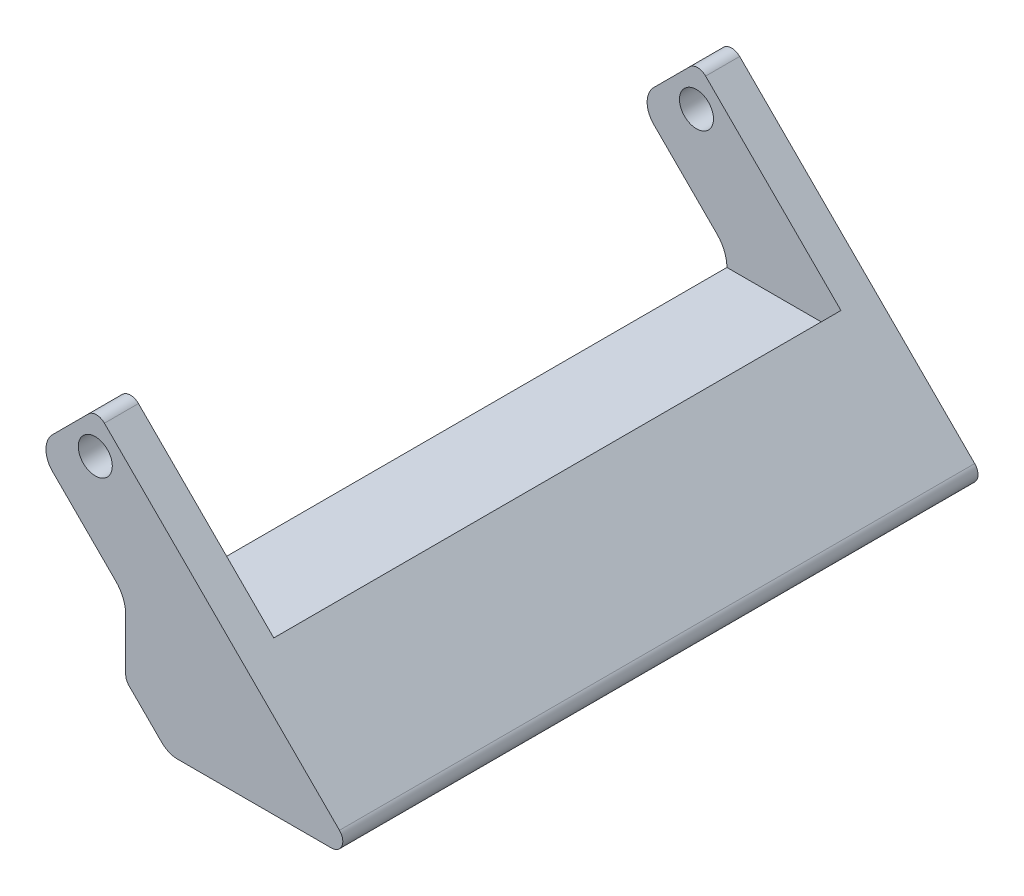
from build123d import *

# Parameters (mm, degrees)
SKETCH1_R           = 1.5
BOSS_EXTRUDE1_DEPTH = 3
BOSS_EXTRUDE2_DEPTH = 25
SKETCH6_W           = 56
SKETCH6_H           = 9.11547301
CUT_EXTRUDE1_DEPTH  = 63.91555103
FILLET1_R           = 2
FILLET2_R           = 1
BOSS_EXTRUDE4_DEPTH = 2.460910909
BOSS_EXTRUDE5_DEPTH = 56
FILLET3_R           = 1


with BuildPart() as part:
    # Sketch1 → Boss-Extrude1 (new body)
    with BuildSketch(Plane.XY):
        with BuildLine():
            ThreePointArc((2.68220241, -18.5), (2.975095629, -19.207106781), (3.68220241, -19.5))
            Line((3.68220241, -19.5), (18.54616344, -19.5))
            ThreePointArc((18.54616344, -19.5), (19.008103207, -19.191341716), (18.899716831, -18.646446609))
            Line((18.899716831, -18.646446609), (15.000000504, -14.746730282))
            Line((15.000000504, -14.746730282), (2.601508845, -2.348238623))
            Line((2.601508845, -2.348238623), (1.894402064, -1.641131842))
            Line((1.894402064, -1.641131842), (2.601508845, -0.934025061))
            Line((2.601508845, -0.934025061), (2.927422074, -0.608111832))
            Line((2.927422074, -0.608111832), (3.634528855, 0.098994949))
            Line((3.634528855, 0.098994949), (2.927422074, 0.806101731))
            Line((2.927422074, 0.806101731), (0.806101731, 2.927422074))
            ThreePointArc((0.806101731, 2.927422074), (0.098994949, 3.220315293), (-0.608111832, 2.927422074))
            Line((-0.608111832, 2.927422074), (-1.641131842, 1.894402064))
            Line((-1.641131842, 1.894402064), (-3.762452186, -0.22691828))
            ThreePointArc((-3.762452186, -0.22691828), (-4.348238623, -1.641131842), (-3.762452186, -3.055345405))
            Line((-3.762452186, -3.055345405), (1.803522753, -8.621320344))
            ThreePointArc((1.803522753, -8.621320344), (2.453841007, -9.59459039), (2.68220241, -10.742640687))
            Line((2.68220241, -10.742640687), (2.68220241, -18.5))
        make_face()
        Circle(SKETCH1_R, mode=Mode.SUBTRACT)
    boss_extrude1 = extrude(amount=BOSS_EXTRUDE1_DEPTH)

    # Sketch2 → Boss-Extrude2 (add)
    with BuildSketch(Plane.XY.offset(3)):
        with BuildLine():
            Line((18.899716831, -18.646446609), (10.995910909, -10.742640687))
            Line((10.995910909, -10.742640687), (2.68220241, -10.742640687))
            Line((2.68220241, -10.742640687), (2.68220241, -18.5))
            ThreePointArc((2.68220241, -18.5), (2.975095629, -19.207106781), (3.68220241, -19.5))
            Line((3.68220241, -19.5), (18.54616344, -19.5))
            ThreePointArc((18.54616344, -19.5), (19.008103207, -19.191341716), (18.899716831, -18.646446609))
        make_face()
    boss_extrude2 = extrude(amount=BOSS_EXTRUDE2_DEPTH)

    # Mirror1: Boss-Extrude1, Boss-Extrude2 across plane
    add(boss_extrude1.mirror(Plane.XY.offset(28)))
    add(boss_extrude2.mirror(Plane.XY.offset(28)))

    # Sketch6 → Cut-Extrude1 (cut, through all)
    with BuildSketch(Plane(origin=(-6.530219139, -6.530219139, 0), x_dir=(0, 0, 1), z_dir=(-0.7071067811865487, -0.7071067811865465, 0))):
        with Locations((28, -17.586068001)):
            Rectangle(SKETCH6_W, SKETCH6_H)
    extrude(amount=CUT_EXTRUDE1_DEPTH, mode=Mode.SUBTRACT)

    # Fillet1
    fillet1_edges = [part.edges().sort_by_distance(p)[0] for p in [
        (6.439561723, -19.5, 28),
    ]]
    fillet(fillet1_edges, radius=FILLET1_R)

    # Fillet2
    fillet2_edges = [part.edges().sort_by_distance(p)[0] for p in [
        (2.68220241, -15.742640687, 28),
    ]]
    fillet(fillet2_edges, radius=FILLET2_R)

    # Sketch9 → Boss-Extrude4 (add)
    with BuildSketch(Plane(origin=(0.126635111, 0.126635111, 0), x_dir=(0, 0, -1), z_dir=(0.7071067811865487, 0.7071067811865465, 0))):
        Polygon((-56, -2.5), (-53, -2.5), (-53, -15.371477247), (-3, -15.371477247), (-3, -2.5), (0, -2.5), (0, -26.549146776), (-56, -26.549146776), align=None)
    extrude(amount=BOSS_EXTRUDE4_DEPTH)

    # Sketch10 → Boss-Extrude5 (add)
    with BuildSketch(Plane(origin=(0, 0, 0), x_dir=(-1, 0, 0), z_dir=(0, 0, -1))):
        Polygon((-20.639843623, -16.906319818), (-18.04616344, -19.5), (-23.233523805, -19.5), align=None)
    extrude(amount=-BOSS_EXTRUDE5_DEPTH)

    # Fillet3
    fillet3_edges = [part.edges().sort_by_distance(p)[0] for p in [
        (23.233523805, -19.5, 28),
    ]]
    fillet(fillet3_edges, radius=FILLET3_R)


solid = part.part
